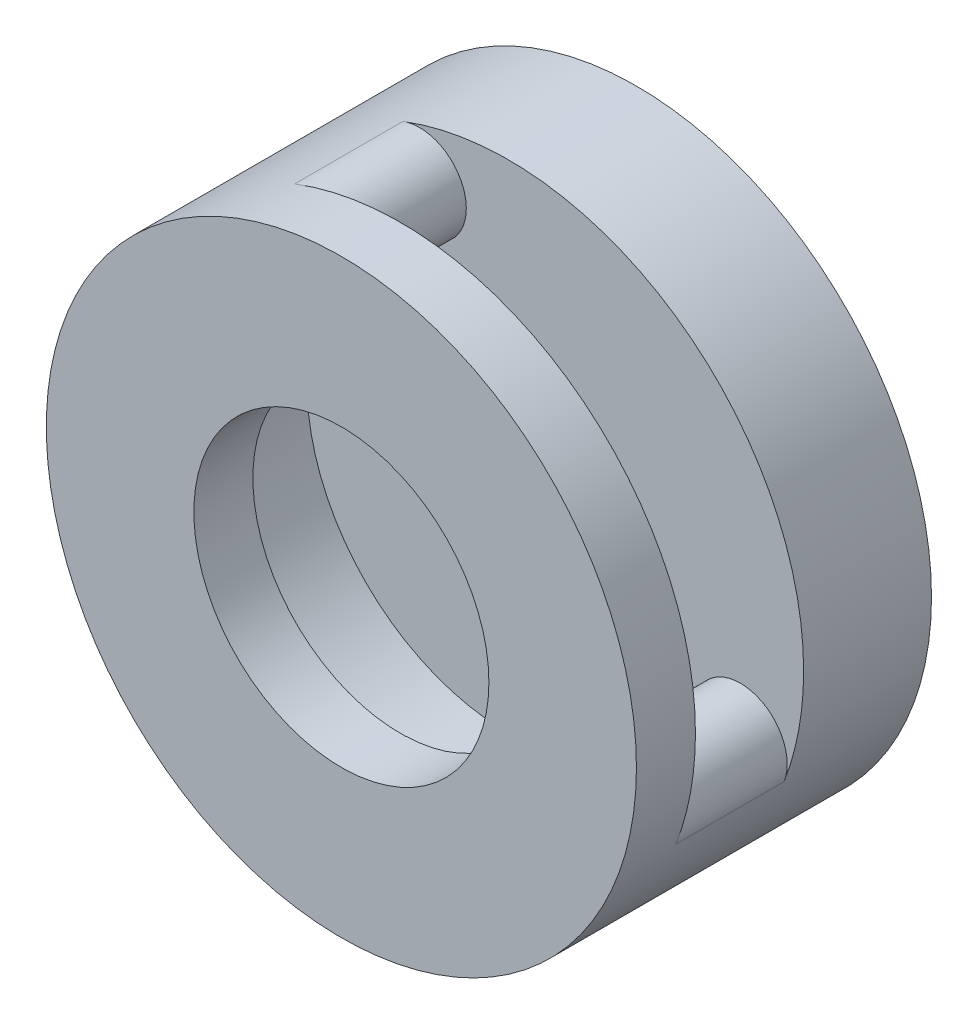
from build123d import *

# Parameters (mm, degrees)
SKETCH_1_R          = 3
EXTRUDE_1_DEPTH     = 3
SKETCH_2_R          = 1.5
CUT_EXTRUDE_1_DEPTH = 0.6
CUT_EXTRUDE_2_DEPTH = 1.1


with BuildPart() as part:
    # 草图1 → 凸台-拉伸1 (new body)
    with BuildSketch(Plane.XY):
        Circle(SKETCH_1_R)
    extrude(amount=EXTRUDE_1_DEPTH)

    # 草图2 → 切除-拉伸1 (cut)
    with BuildSketch(Plane.XY.offset(3)):
        Circle(SKETCH_2_R)
    extrude(amount=-CUT_EXTRUDE_1_DEPTH, mode=Mode.SUBTRACT)

    # 草图3 → 切除-拉伸2 (cut)
    with BuildSketch(Plane.XY.offset(2.4)):
        with BuildLine():
            Line((-1.075103849, 2.800741279), (-1.343879811, 3.500926599))
            ThreePointArc((-1.343879811, 3.500926599), (2.651650429, 2.651650429), (3.500926599, -1.343879811))
            Line((3.500926599, -1.343879811), (2.800741279, -1.075103849))
            ThreePointArc((2.800741279, -1.075103849), (2.527515353, -0.46142837), (1.913839874, -0.734654297))
            ThreePointArc((1.913839874, -0.734654297), (-1.449568901, -1.449568901), (-0.734654297, 1.913839874))
            ThreePointArc((-0.734654297, 1.913839874), (-0.46142837, 2.527515353), (-1.075103849, 2.800741279))
        make_face()
    extrude(amount=-CUT_EXTRUDE_2_DEPTH, mode=Mode.SUBTRACT)


solid = part.part
